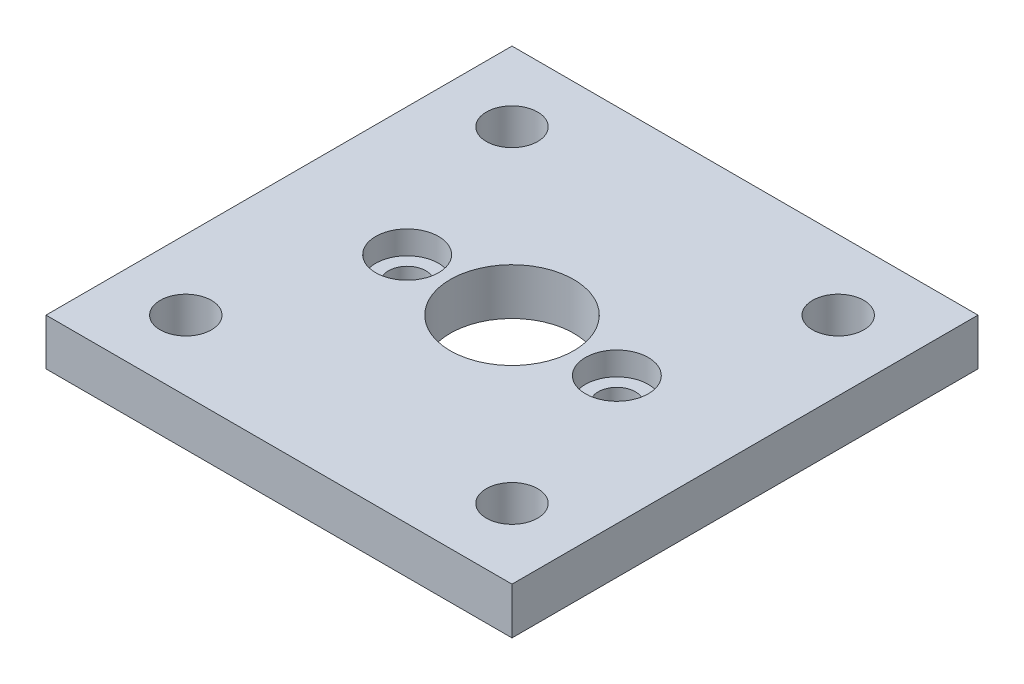
from build123d import *

# Parameters (mm, degrees)
SKETCH_1_W          = 20
SKETCH_1_H          = 20
SKETCH_1_R          = 0.8
SKETCH_1_R_2        = 2.65
EXTRUDE_1_DEPTH     = 2
SKETCH_2_R          = 1.35
CUT_EXTRUDE_1_DEPTH = 1
SKETCH_3_R          = 1.1
CUT_EXTRUDE_2_DEPTH = 15.282856857


with BuildPart() as part:
    # 草图1 → 凸台-拉伸1 (new body)
    with BuildSketch(Plane(origin=(0, 0, 0), x_dir=(1, 0, 0), z_dir=(0, 1, 0))):
        Rectangle(SKETCH_1_W, SKETCH_1_H)
        with Locations(Location((-4.5, 0, 0), (0, 0, 270))):
            Circle(SKETCH_1_R, mode=Mode.SUBTRACT)
        with Locations(Location((4.5, 0, 0), (0, 0, 270))):
            Circle(SKETCH_1_R, mode=Mode.SUBTRACT)
        with Locations(Location((0, 0, 0), (0, 0, 270))):
            Circle(SKETCH_1_R_2, mode=Mode.SUBTRACT)
    extrude(amount=EXTRUDE_1_DEPTH)

    # 草图2 → 切除-拉伸1 (cut)
    with BuildSketch(Plane(origin=(0, 2, 0), x_dir=(1, 0, 0), z_dir=(0, 1, 0))):
        with Locations(Location((-4.5, 0, 0), (0, 0, 270))):
            Circle(SKETCH_2_R)
        with Locations(Location((4.5, 0, 0), (0, 0, 270))):
            Circle(SKETCH_2_R)
    extrude(amount=-CUT_EXTRUDE_1_DEPTH, mode=Mode.SUBTRACT)

    # 草图3 → 切除-拉伸2 (cut, through all)
    with BuildSketch(Plane.XZ):
        with Locations(Location((-7, 7, 0), (0, 0, 270))):
            Circle(SKETCH_3_R)
        with Locations(Location((7, 7, 0), (0, 0, 270))):
            Circle(SKETCH_3_R)
        with Locations(Location((7, -7, 0), (0, 0, 270))):
            Circle(SKETCH_3_R)
        with Locations(Location((-7, -7, 0), (0, 0, 270))):
            Circle(SKETCH_3_R)
    extrude(amount=-CUT_EXTRUDE_2_DEPTH, mode=Mode.SUBTRACT)


solid = part.part
